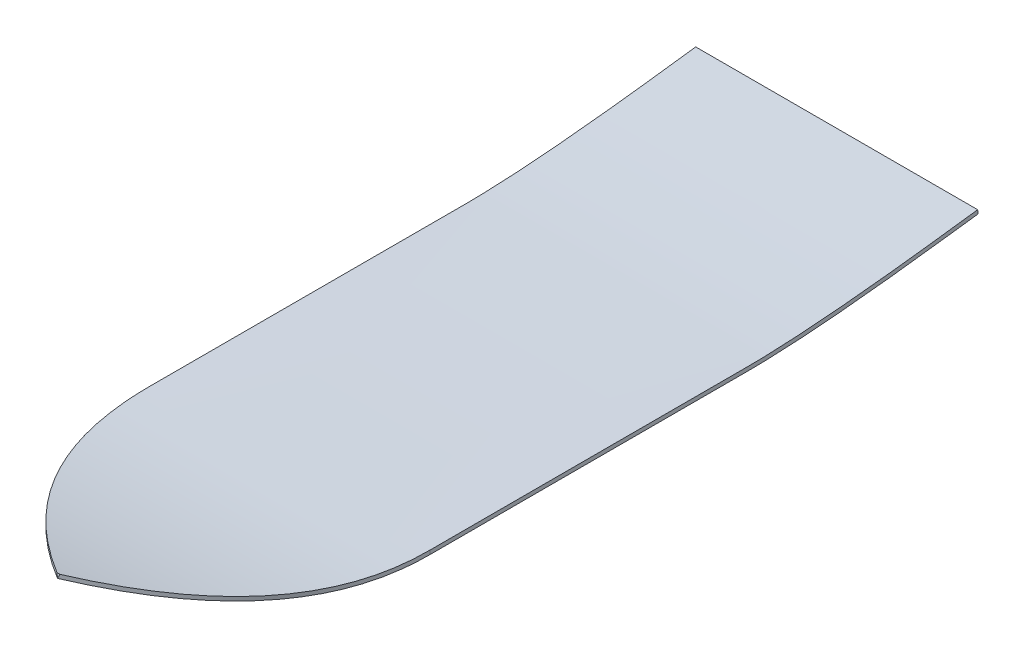
from build123d import *

# Parameters (mm, degrees)
BOSS_EXTRUDE1_DEPTH      = 1524
BOSS_EXTRUDE1_DEPTH_BACK = 1524
CUT_EXTRUDE1_DEPTH       = 2942.665115012
CUT_EXTRUDE1_DEPTH_BACK  = 2942.665115012
SKETCH3_W                = 5731.45735109
SKETCH3_H                = 8003.30588206


with BuildPart() as part:
    # Sketch1 → Boss-Extrude1 (new, two sides: drawn at the far end of the back side and taken through both)
    with BuildSketch(Plane(origin=(0, 0, 0), x_dir=(0, 0, -1), z_dir=(1, 0, 0)).offset(-BOSS_EXTRUDE1_DEPTH_BACK)):
        with BuildLine():
            Line((-2503.233310767, 184.281566757), (-2509.354090635, 160.042423748))
            add(Edge.make_bspline(
                [(-2509.354090635, 160.042423748), (-2503.952023839, 158.67831357), (-2493.152528894, 155.973815668), (-2471.452443131, 150.629487774), (-2444.19288272, 144.084228969), (-2411.249015413, 136.441750774), (-2367.020153637, 126.53571356), (-2311.16183009, 114.684718205), (-2243.21720375, 101.31388057), (-2174.357748261, 88.79299818), (-2081.325486445, 73.231340323), (-1962.748297635, 55.902540428), (-1816.796562049, 38.502751443), (-1667.185389394, 24.495422867), (-1513.913715508, 13.878725952), (-1383.1370579, 7.85531502), (-1276.684159972, 4.729968107), (-1209.391392047, 3.480943057), (-1155.092964864, 2.906576199), (-1120.980991282, 2.719408736), (-1093.540264196, 2.685601576), (-1066.160077723, 2.696815216), (-1031.941705636, 2.698113125), (-990.876191939, 2.704097175), (-936.122988043, 2.710815974), (-840.303929542, 2.723767694), (-703.419553608, 2.742366704), (-539.158355278, 2.764644903), (-374.897145258, 2.786927523), (-210.63593611, 2.809211273), (-46.374724944, 2.831496146), (117.886483665, 2.853780359), (282.147699658, 2.876065946), (419.032089868, 2.894811115), (528.539548164, 2.909995051), (610.670091322, 2.921276486), (692.800548499, 2.932252624), (774.931148615, 2.942767111), (843.372753963, 2.950871394), (891.282960864, 2.956338158), (918.66122186, 2.960772974), (934.061410024, 2.963992952), (944.328807398, 2.966525568), (949.461622083, 2.967900589), (954.597967875, 2.96927189), (958.889736253, 2.971978382), (962.337759189, 2.977965686), (964.827708547, 2.980113232), (967.216420344, 2.968892052), (969.736346073, 2.944466066), (972.37649452, 2.920457201), (975.863944972, 2.896605731), (980.205645141, 2.872852634), (985.446327049, 2.851988295), (992.457928461, 2.835023323), (1004.801313704, 2.833587248), (1022.628824739, 2.912353642), (1044.320264182, 3.132518526), (1073.620786647, 3.589151132), (1110.921509018, 4.457211704), (1156.649438421, 5.947630094), (1218.757906114, 8.497553696), (1298.242080687, 12.673521788), (1395.663094004, 19.055735844), (1494.201670767, 26.599163325), (1592.932603479, 35.094263196), (1723.593834157, 47.410913447), (1850.927863141, 60.79402267), (1971.212962455, 74.40733598), (2056.970393474, 84.523378543), (2137.338984451, 94.336390114), (2211.385272306, 103.63720918), (2278.174397941, 112.216518685), (2327.003443602, 118.59002374), (2361.49816757, 123.118117339), (2384.965945238, 126.202394956), (2405.910242679, 128.948292976), (2424.208106929, 131.328898181), (2437.144494249, 132.985429541), (2446.035754442, 134.099804447), (2451.954690542, 134.826256318), (2457.099945739, 135.439162364), (2460.71754008, 135.851346447), (2463.184721709, 136.118927179), (2464.814093716, 136.287768117), (2465.970265008, 136.400485266), (2466.778786352, 136.474509366), (2467.11607425, 136.503870055), (2467.293149976, 136.518804351)],
                knots=[0.002418345, 0.002418345, 0.002418345, 0.002418345, 0.006315149, 0.010211952, 0.018005559, 0.025799165, 0.033592772, 0.049179986, 0.064767199, 0.080354412, 0.095941626, 0.127116052, 0.158290479, 0.189464906, 0.220639332, 0.251813759, 0.267400972, 0.282988186, 0.290781792, 0.298575399, 0.302472202, 0.306369006, 0.314162612, 0.321956219, 0.329749826, 0.345337039, 0.376511466, 0.407685893, 0.438860319, 0.470034746, 0.501209173, 0.532383599, 0.563558026, 0.594732453, 0.610319666, 0.62590688, 0.641494093, 0.657081306, 0.67266852, 0.680462126, 0.68435893, 0.688255733, 0.689229934, 0.690204135, 0.691178335, 0.692152536, 0.692639637, 0.693126737, 0.693613838, 0.694100938, 0.694588038, 0.695075139, 0.69604934, 0.69702354, 0.697997741, 0.699946143, 0.703842946, 0.70773975, 0.711636553, 0.71943016, 0.727223766, 0.735017373, 0.750604586, 0.7661918, 0.781779013, 0.797366226, 0.81295344, 0.844127866, 0.85971508, 0.875302293, 0.890889507, 0.90647672, 0.922063933, 0.937651147, 0.945444753, 0.95323836, 0.961031967, 0.968825573, 0.97661918, 0.980515983, 0.984412787, 0.98830959, 0.992206393, 0.994154795, 0.996103197, 0.998051598, 0.999025799, 1, 1, 1, 1], degree=3))
            Line((2467.293149976, 136.518804351), (2465.192147133, 161.430363657))
            add(Edge.make_bspline(
                [(-2503.233310767, 184.281566757), (-2291.503647912, 130.81636556), (-1972.714702591, 74.882344987), (-1498.53377686, 35.602573852), (-1252.937439566, 28.082807491), (-1102.453690819, 27.687712134), (-1068.14730463, 27.694509253), (-965.237039082, 27.70676116), (-786.855911384, 27.731049361), (-409.511435932, 27.782228942), (2.137102132, 27.838078959), (468.672104045, 27.901368421), (748.24998241, 27.940798047), (921.485667478, 27.95957559), (959.219781377, 27.970691042), (966.079309897, 27.985539558), (971.231483296, 27.928083079), (981.582076287, 27.858723919), (1053.039529096, 27.657156063), (1188.267881601, 31.18674686), (1808.755243406, 68.038558912), (2414.539493341, 157.158396242), (2465.192147133, 161.430363657)],
                knots=[0.002418345, 0.002418345, 0.002418345, 0.002418345, 0.15625, 0.21875, 0.296875, 0.30078125, 0.3046875, 0.31640625, 0.359375, 0.40625, 0.53125, 0.59375, 0.671875, 0.690429688, 0.692382812, 0.693359375, 0.694335938, 0.6953125, 0.69921875, 0.734375, 0.765625, 1, 1, 1, 1], degree=3))
        make_face()
    extrude(amount=BOSS_EXTRUDE1_DEPTH + BOSS_EXTRUDE1_DEPTH_BACK)

    # Sketch3 → Cut-Extrude1 (cut, two sides: drawn at the far end of the back side and taken through both)
    with BuildSketch(Plane(origin=(0, 0, 0), x_dir=(1, 0, 0), z_dir=(0, 1, 0)).offset(-CUT_EXTRUDE1_DEPTH_BACK)):
        with Locations((-68.47307406, 83.588987295)):
            Rectangle(SKETCH3_W, SKETCH3_H)
        with BuildLine():
            Line((-900, 2487.881921546), (900, 2487.881921546))
            Line((900, 2487.881921546), (900, -1029.651729007))
            add(Edge.make_bspline(
                [(900, -1029.651729007), (900, -1904.29033419), (0, -2509.354090635)],
                knots=[0, 0, 0, 1, 1, 1], degree=2))
            add(Edge.make_bspline(
                [(-900, -1029.651729007), (-900, -1904.29033419), (0, -2509.354090635)],
                knots=[0, 0, 0, 1, 1, 1], degree=2))
            Line((-900, -1029.651729007), (-900, 2487.881921546))
        make_face(mode=Mode.SUBTRACT)
    extrude(amount=CUT_EXTRUDE1_DEPTH + CUT_EXTRUDE1_DEPTH_BACK, mode=Mode.SUBTRACT)


solid = part.part
